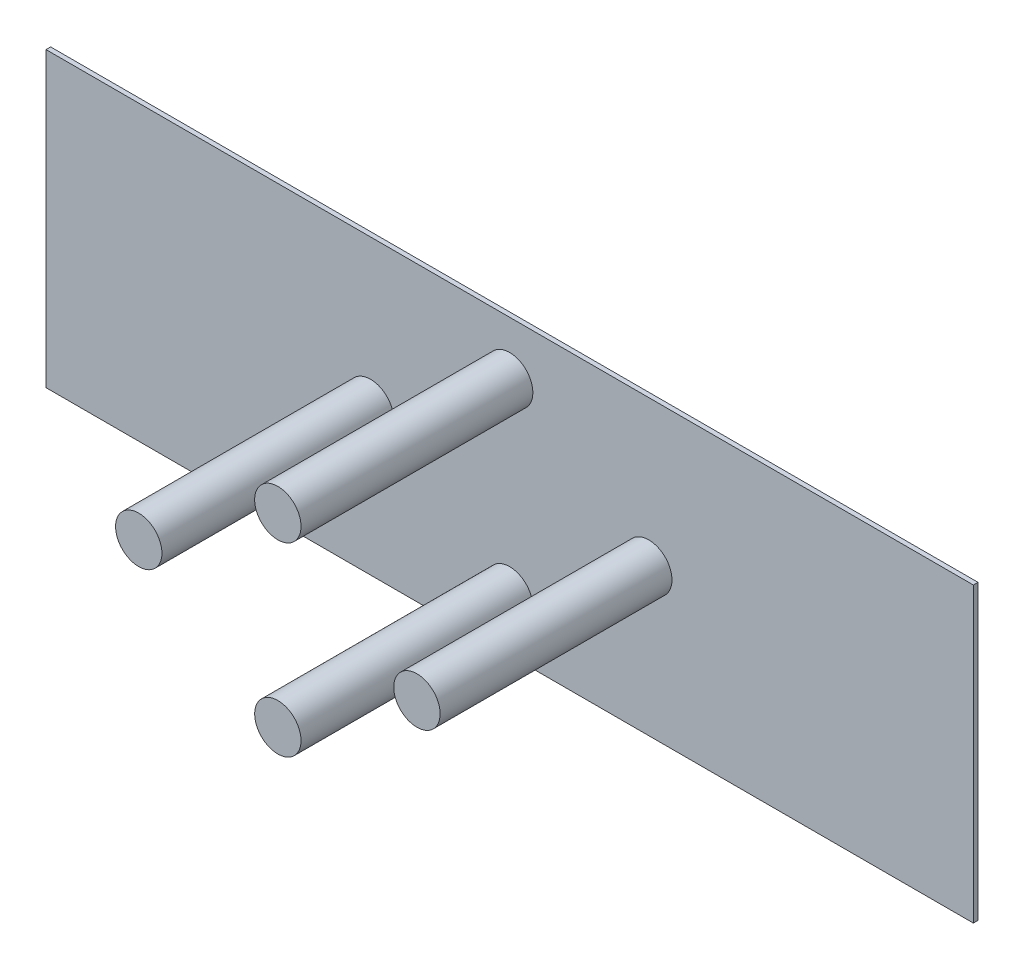
from build123d import *

# Parameters (mm, degrees)
SKETCH6_W           = 20000
SKETCH6_H           = 6315.085915388
BOSS_EXTRUDE3_DEPTH = 100
SKETCH7_R           = 500
BOSS_EXTRUDE4_DEPTH = 5000


with BuildPart() as part:
    # Sketch6 → Boss-Extrude3 (new body)
    with BuildSketch(Plane.XY):
        with Locations((5000, 0)):
            Rectangle(SKETCH6_W, SKETCH6_H)
    extrude(amount=-BOSS_EXTRUDE3_DEPTH)

    # Sketch7 → Boss-Extrude4 (add)
    with BuildSketch(Plane.XY):
        with Locations((2000, 0)):
            Circle(SKETCH7_R)
        with Locations((8000, 0)):
            Circle(SKETCH7_R)
        with Locations((5000, 2000)):
            Circle(SKETCH7_R)
        with Locations(Location((5000, -2000, 0), (0, 0, 180))):
            Circle(SKETCH7_R)
    extrude(amount=BOSS_EXTRUDE4_DEPTH)


solid = part.part
